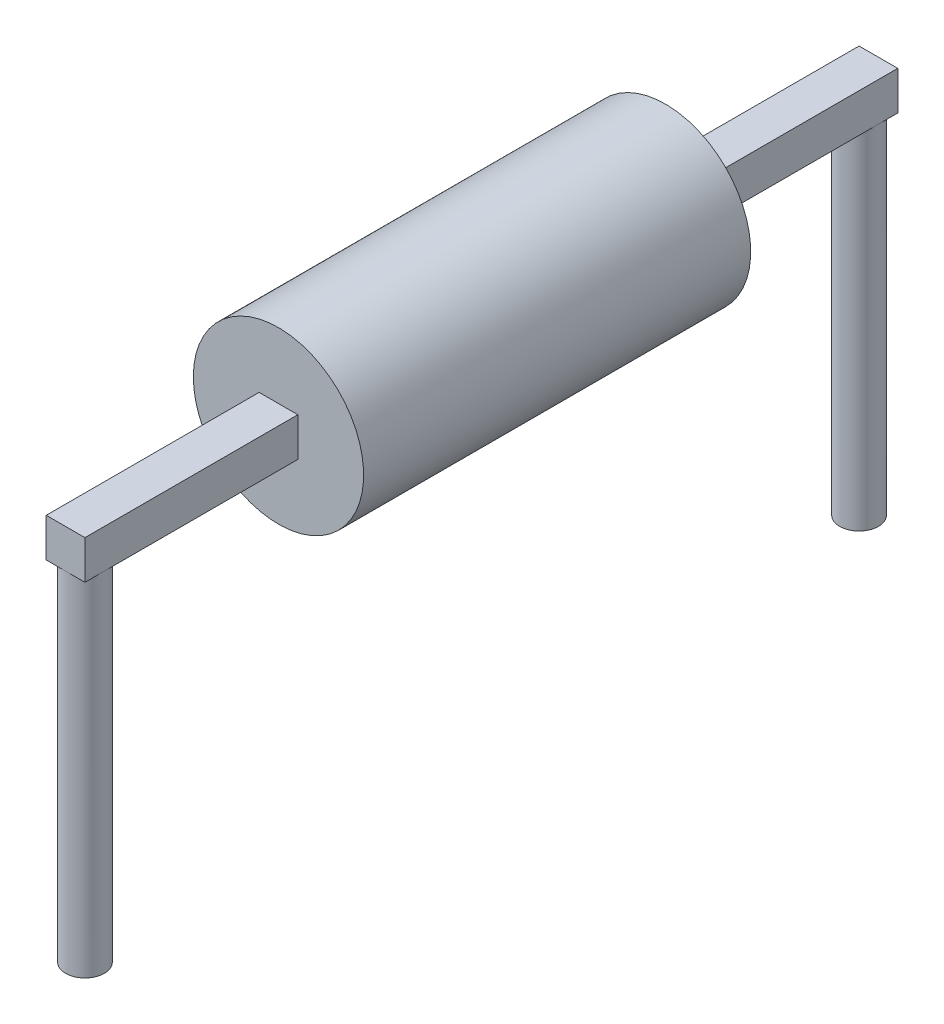
from build123d import *

# Parameters (mm, degrees)
SKETCH_1_R           = 1.1
EXTRUDE_1_DEPTH      = 5
EXTRUDE_2_DEPTH      = 2.75
EXTRUDE_2_DEPTH_BACK = 7.75
SKETCH_2_W           = 0.5
SKETCH_2_H           = 0.5
SKETCH_3_R           = 0.25
EXTRUDE_3_DEPTH      = 4.5


with BuildPart() as part:
    # Эскиз1 → Вытянуть1 (new body)
    with BuildSketch(Plane.XY):
        Circle(SKETCH_1_R)
    extrude(amount=EXTRUDE_1_DEPTH)

    # Эскиз2 → Вытянуть2 (add, two sides: drawn at the far end of the back side and taken through both)
    with BuildSketch(Plane.XY.offset(5).offset(-EXTRUDE_2_DEPTH_BACK)):
        with Locations((-0.000117439, 0)):
            Rectangle(SKETCH_2_W, SKETCH_2_H)
    extrude(amount=EXTRUDE_2_DEPTH + EXTRUDE_2_DEPTH_BACK)

    # Эскиз3 → Вытянуть3 (add)
    with BuildSketch(Plane.XZ.offset(0.25)):
        with Locations((0, 7.5)):
            Circle(SKETCH_3_R)
        with Locations((0, -2.5)):
            Circle(SKETCH_3_R)
    extrude(amount=EXTRUDE_3_DEPTH)


solid = part.part
